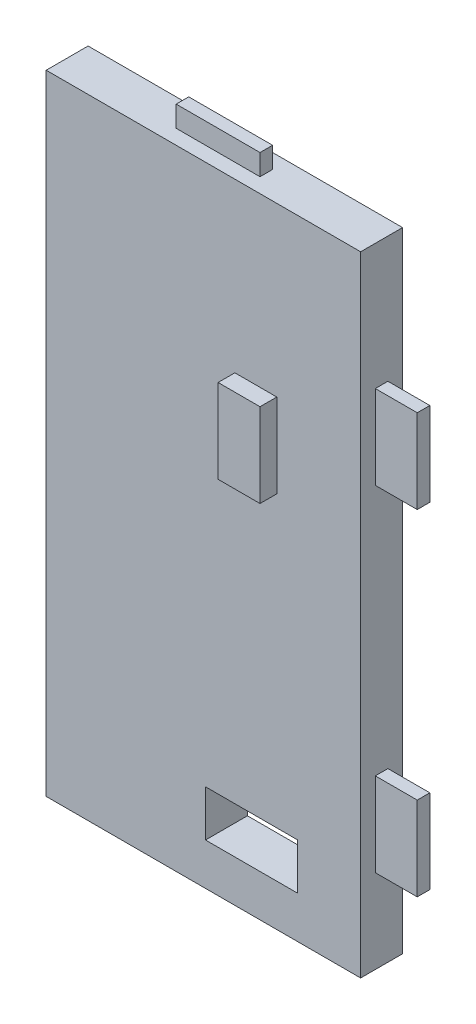
from build123d import *

# Parameters (mm, degrees)
SKETCH1_W           = 150
SKETCH1_H           = 75
SKETCH1_W_2         = 11
SKETCH1_H_2         = 22
BOSS_EXTRUDE1_DEPTH = 10
SKETCH2_W           = 10
SKETCH2_H           = 20
BOSS_EXTRUDE2_DEPTH = 4
SKETCH3_W           = 20
SKETCH3_H           = 3
BOSS_EXTRUDE3_DEPTH = 10
SKETCH4_W           = 20
SKETCH4_H           = 3
BOSS_EXTRUDE4_DEPTH = 5


with BuildPart() as part:
    # Sketch1 → Boss-Extrude1 (new body)
    with BuildSketch(Plane(origin=(0, 0, 0), x_dir=(0, 1, 0), z_dir=(0, 0, 1))):
        Rectangle(SKETCH1_W, SKETCH1_H)
        with Locations((-59.5, -11.5)):
            Rectangle(SKETCH1_W_2, SKETCH1_H_2, mode=Mode.SUBTRACT)
    extrude(amount=BOSS_EXTRUDE1_DEPTH)

    # Sketch2 → Boss-Extrude2 (add)
    with BuildSketch(Plane.XY.offset(10)):
        with Locations((12.5, 25)):
            Rectangle(SKETCH2_W, SKETCH2_H)
    extrude(amount=BOSS_EXTRUDE2_DEPTH)

    # Sketch3 → Boss-Extrude3 (add)
    with BuildSketch(Plane.YZ.offset(37.5)):
        with Locations((-45, 5)):
            Rectangle(SKETCH3_W, SKETCH3_H)
        with Locations((35, 5)):
            Rectangle(SKETCH3_W, SKETCH3_H)
    extrude(amount=BOSS_EXTRUDE3_DEPTH)

    # Sketch4 → Boss-Extrude4 (add)
    with BuildSketch(Plane(origin=(0, 75, 0), x_dir=(-1, 0, 0), z_dir=(0, 1, 0))):
        with Locations((0, 5)):
            Rectangle(SKETCH4_W, SKETCH4_H)
    extrude(amount=BOSS_EXTRUDE4_DEPTH)


solid = part.part
